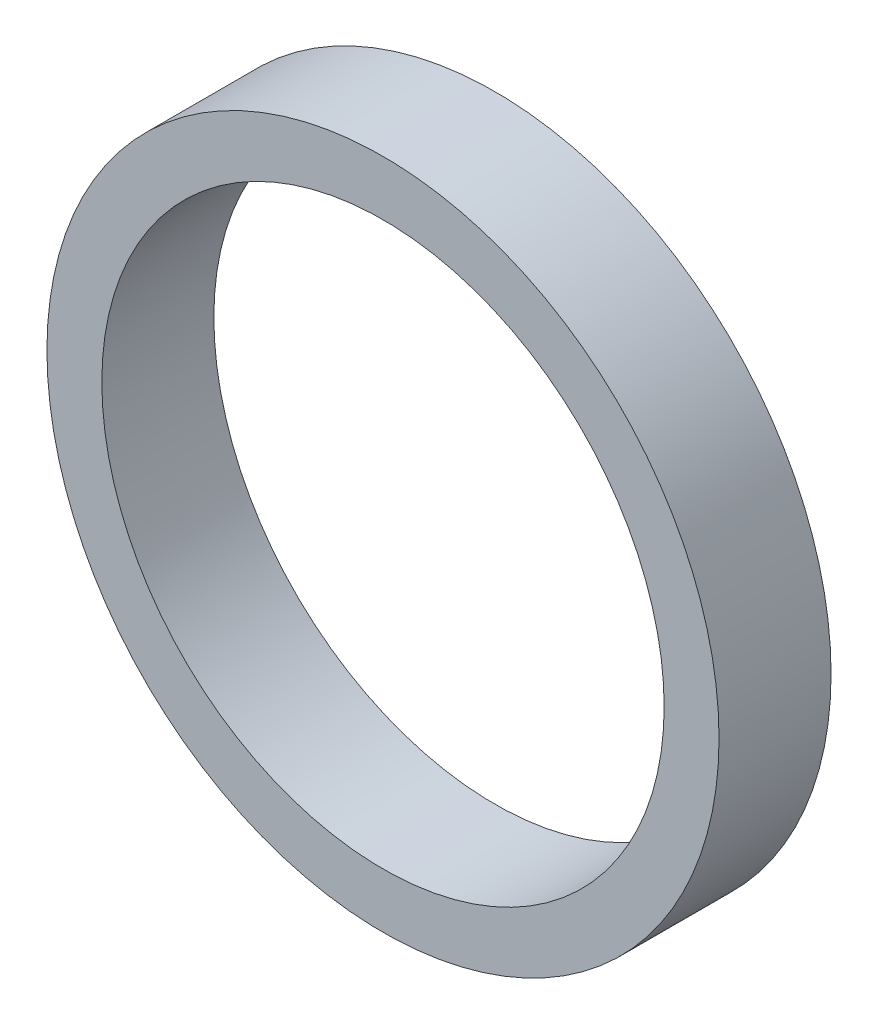
from build123d import *

# Parameters (mm, degrees)
SKETCH1_R      = 19.05
SKETCH1_R_2    = 15.9385
EXTRUDE1_DEPTH = 3.175


with BuildPart() as part:
    # Sketch1 → Extrude1 (new, symmetric)
    with BuildSketch(Plane.XY):
        Circle(SKETCH1_R)
        Circle(SKETCH1_R_2, mode=Mode.SUBTRACT)
    extrude(amount=EXTRUDE1_DEPTH, both=True)


solid = part.part
